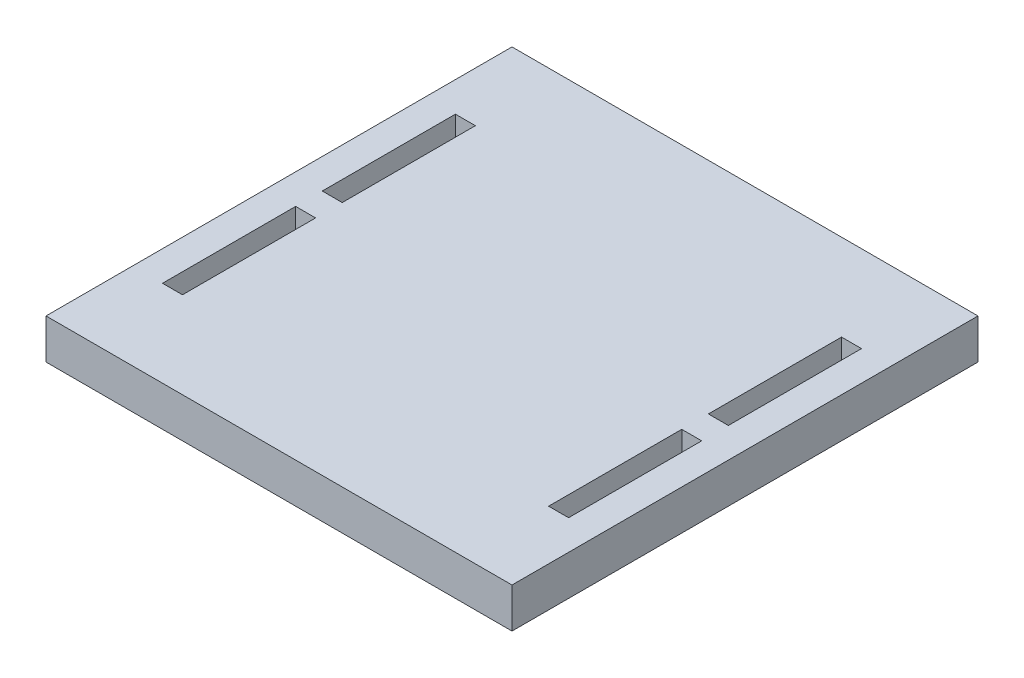
from build123d import *

# Parameters (mm, degrees)
SKETCH_1_W      = 70
SKETCH_1_H      = 70
SKETCH_1_W_2    = 3
SKETCH_1_H_2    = 20
EXTRUDE_1_DEPTH = 6


with BuildPart() as part:
    # 草图1 → 凸台-拉伸1 (new body)
    with BuildSketch(Plane(origin=(0, 0, 0), x_dir=(1, 0, 0), z_dir=(0, 1, 0))):
        with Locations((35, -35)):
            Rectangle(SKETCH_1_W, SKETCH_1_H)
        with Locations((6, -23)):
            Rectangle(SKETCH_1_W_2, SKETCH_1_H_2, mode=Mode.SUBTRACT)
        with Locations((6, -47)):
            Rectangle(SKETCH_1_W_2, SKETCH_1_H_2, mode=Mode.SUBTRACT)
        with Locations((64, -47)):
            Rectangle(SKETCH_1_W_2, SKETCH_1_H_2, mode=Mode.SUBTRACT)
        with Locations((64, -23)):
            Rectangle(SKETCH_1_W_2, SKETCH_1_H_2, mode=Mode.SUBTRACT)
    extrude(amount=EXTRUDE_1_DEPTH)


solid = part.part
